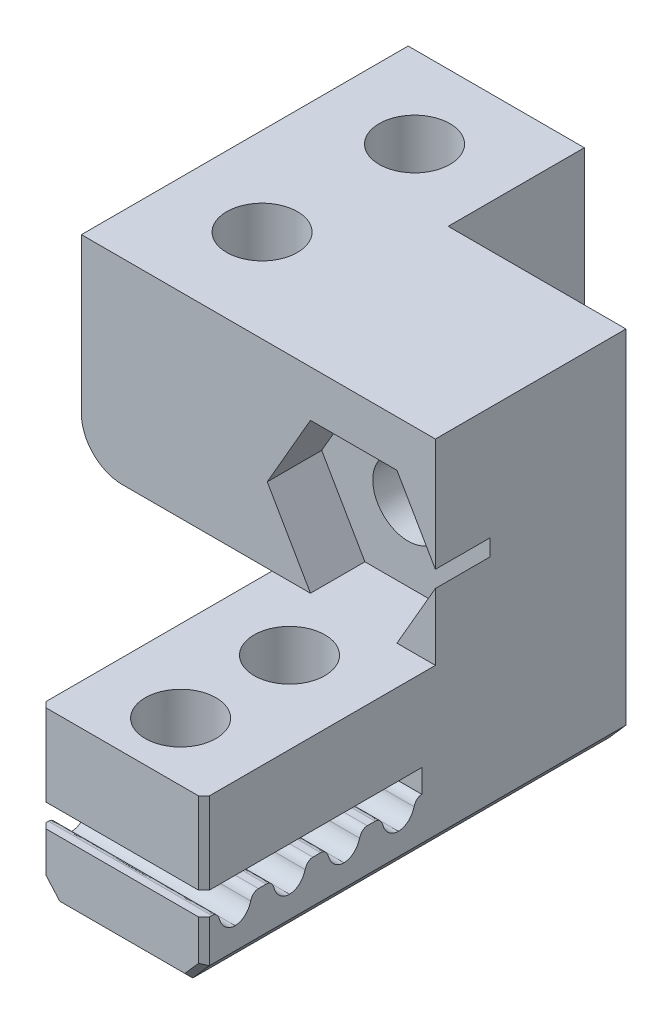
from build123d import *

# Parameters (mm, degrees)
BOSS_EXTRUDE1_DEPTH     = 13
SKETCH6_W               = 6
SKETCH6_H               = 5
BOSS_EXTRUDE4_DEPTH     = 5.6
SKETCH16_W              = 6
SKETCH16_H              = 8
BOSS_EXTRUDE5_DEPTH     = 0.1
CUT_EXTRUDE6_DEPTH      = 4
CUT_EXTRUDE6_DEPTH_BACK = 3.6
SKETCH15_R              = 1.3
CUT_EXTRUDE7_DEPTH      = 8.7202
CUT_EXTRUDE8_START      = -0.2202
SKETCH19_W              = 6
SKETCH19_H              = 8
SKETCH19_R              = 1.3
CUT_EXTRUDE8_DEPTH      = 0.2202
SKETCH12_R              = 1.2
CUT_EXTRUDE5_DEPTH      = 6
SKETCH21_R              = 1.2
BOSS_EXTRUDE6_DEPTH     = 2.5
SKETCH24_W              = 6
SKETCH24_H              = 5.5
CUT_EXTRUDE10_DEPTH     = 8.5
BOSS_EXTRUDE8_DEPTH     = 7.2
FILLET4_R               = 1.5
SKETCH26_R              = 1.3
CUT_EXTRUDE11_DEPTH     = 10
CHAMFER1_SIZE           = 0.2
BOSS_EXTRUDE9_DEPTH     = 5
SKETCH31_R              = 1.3
CUT_EXTRUDE12_DEPTH     = 8
CROQUIS1_W              = 20.968017067
CROQUIS1_H              = 19.092350392
CORTAR_EXTRUIR1_DEPTH   = 0.5
CORTAR_EXTRUIR2_DEPTH   = 2


with BuildPart() as part:
    # Sketch1 → Boss-Extrude1 (new body)
    with BuildSketch(Plane.XY):
        Polygon((3, 3.05), (3, -2.253801214), (2.388188946, -2.95), (-2.388188946, -2.95), (-3, -2.253801214), (-3, 3.05), align=None)
    extrude(amount=BOSS_EXTRUDE1_DEPTH)

    # Sketch6 → Boss-Extrude4 (add)
    with BuildSketch(Plane(origin=(0, 3.05, 0), x_dir=(1, 0, 0), z_dir=(0, 1, 0))):
        with Locations((0, -2.5)):
            Rectangle(SKETCH6_W, SKETCH6_H)
    extrude(amount=BOSS_EXTRUDE4_DEPTH)

    # Sketch16 → Boss-Extrude5 (add)
    with BuildSketch(Plane(origin=(0, 3.05, 0), x_dir=(1, 0, 0), z_dir=(0, 1, 0))):
        with Locations((0, -9)):
            Rectangle(SKETCH16_W, SKETCH16_H)
    extrude(amount=BOSS_EXTRUDE5_DEPTH)

    # Sketch18 → Cut-Extrude6 (cut, two sides: drawn at the far end of the back side and taken through both)
    with BuildSketch(Plane(origin=(0, 0, 0), x_dir=(0, 0, -1), z_dir=(1, 0, 0)).offset(-CUT_EXTRUDE6_DEPTH_BACK)):
        with BuildLine():
            Line((-8.8572, -0.0702), (-12.8572, -0.0702))
            Line((-12.8572, -0.0702), (-13, -0.0702))
            Line((-13, -0.0702), (-13, -0.7))
            Line((-13, -0.7), (-12.8572, -0.7))
            Line((-12.8572, -0.7), (-12.7144, -0.7))
            add(Edge.make_bspline(
                [(-12.7144, -0.7), (-12.5198, -0.7), (-12.43, -0.9509)],
                knots=[0.103448276, 0.103448276, 0.103448276, 0.137931034, 0.137931034, 0.137931034], degree=2))
            add(Edge.make_bspline(
                [(-12.43, -0.9509), (-12.3594, -1.2388), (-12.13, -1.45), (-11.8572, -1.45)],
                knots=[0.137931034, 0.137931034, 0.137931034, 0.137931034, 0.172413793, 0.172413793, 0.172413793, 0.172413793], degree=3))
            add(Edge.make_bspline(
                [(-11.8572, -1.45), (-11.5844, -1.45), (-11.355, -1.2388), (-11.2844, -0.9509)],
                knots=[0.172413793, 0.172413793, 0.172413793, 0.172413793, 0.206896552, 0.206896552, 0.206896552, 0.206896552], degree=3))
            add(Edge.make_bspline(
                [(-11.2844, -0.9509), (-11.1946, -0.7), (-11, -0.7)],
                knots=[0.206896552, 0.206896552, 0.206896552, 0.24137931, 0.24137931, 0.24137931], degree=2))
            Line((-11, -0.7), (-10.8572, -0.7))
            Line((-10.8572, -0.7), (-10.7144, -0.7))
            add(Edge.make_bspline(
                [(-10.7144, -0.7), (-10.5198, -0.7), (-10.43, -0.9509)],
                knots=[0.310344828, 0.310344828, 0.310344828, 0.344827586, 0.344827586, 0.344827586], degree=2))
            add(Edge.make_bspline(
                [(-10.43, -0.9509), (-10.3594, -1.2388), (-10.13, -1.45), (-9.8572, -1.45)],
                knots=[0.344827586, 0.344827586, 0.344827586, 0.344827586, 0.379310345, 0.379310345, 0.379310345, 0.379310345], degree=3))
            add(Edge.make_bspline(
                [(-9.8572, -1.45), (-9.5844, -1.45), (-9.355, -1.2388), (-9.2844, -0.9509)],
                knots=[0.379310345, 0.379310345, 0.379310345, 0.379310345, 0.413793103, 0.413793103, 0.413793103, 0.413793103], degree=3))
            add(Edge.make_bspline(
                [(-9.2844, -0.9509), (-9.1946, -0.7), (-9, -0.7)],
                knots=[0.413793103, 0.413793103, 0.413793103, 0.448275862, 0.448275862, 0.448275862], degree=2))
            Line((-9, -0.7), (-8.8572, -0.7))
            Line((-8.8572, -0.7), (-8.7144, -0.7))
            add(Edge.make_bspline(
                [(-8.7144, -0.7), (-8.5198, -0.7), (-8.43, -0.9509)],
                knots=[0.517241379, 0.517241379, 0.517241379, 0.551724138, 0.551724138, 0.551724138], degree=2))
            add(Edge.make_bspline(
                [(-8.43, -0.9509), (-8.3594, -1.2388), (-8.13, -1.45), (-7.8572, -1.45)],
                knots=[0.551724138, 0.551724138, 0.551724138, 0.551724138, 0.586206897, 0.586206897, 0.586206897, 0.586206897], degree=3))
            add(Edge.make_bspline(
                [(-7.8572, -1.45), (-7.5844, -1.45), (-7.355, -1.2388), (-7.2844, -0.9509)],
                knots=[0.586206897, 0.586206897, 0.586206897, 0.586206897, 0.620689655, 0.620689655, 0.620689655, 0.620689655], degree=3))
            add(Edge.make_bspline(
                [(-7.2844, -0.9509), (-7.1946, -0.7), (-7, -0.7)],
                knots=[0.620689655, 0.620689655, 0.620689655, 0.655172414, 0.655172414, 0.655172414], degree=2))
            Line((-7, -0.7), (-6.8572, -0.7))
            Line((-6.8572, -0.7), (-6.7144, -0.7))
            add(Edge.make_bspline(
                [(-6.7144, -0.7), (-6.5198, -0.7), (-6.43, -0.9509)],
                knots=[0.724137931, 0.724137931, 0.724137931, 0.75862069, 0.75862069, 0.75862069], degree=2))
            add(Edge.make_bspline(
                [(-6.43, -0.9509), (-6.3594, -1.2388), (-6.13, -1.45), (-5.8572, -1.45)],
                knots=[0.75862069, 0.75862069, 0.75862069, 0.75862069, 0.793103448, 0.793103448, 0.793103448, 0.793103448], degree=3))
            add(Edge.make_bspline(
                [(-5.8572, -1.45), (-5.5844, -1.45), (-5.355, -1.2388), (-5.2844, -0.9509)],
                knots=[0.793103448, 0.793103448, 0.793103448, 0.793103448, 0.827586207, 0.827586207, 0.827586207, 0.827586207], degree=3))
            add(Edge.make_bspline(
                [(-5.2844, -0.9509), (-5.1946, -0.7), (-5, -0.7)],
                knots=[0.827586207, 0.827586207, 0.827586207, 0.862068966, 0.862068966, 0.862068966], degree=2))
            Line((-5, -0.7), (-5, -0.0702))
            Line((-5, -0.0702), (-8.8572, -0.0702))
        make_face()
    extrude(amount=CUT_EXTRUDE6_DEPTH + CUT_EXTRUDE6_DEPTH_BACK, mode=Mode.SUBTRACT)

    # Sketch15 → Cut-Extrude7 (cut)
    with BuildSketch(Plane(origin=(0, 8.65, 0), x_dir=(1, 0, 0), z_dir=(0, 1, 0))):
        with Locations(Location((0, -10.8572, 0), (0, 0, 180))):
            Circle(SKETCH15_R)
        with Locations(Location((0, -6.8572, 0), (0, 0, 180))):
            Circle(SKETCH15_R)
    extrude(amount=-CUT_EXTRUDE7_DEPTH, mode=Mode.SUBTRACT)

    # Sketch19 → Cut-Extrude8 (cut)
    with BuildSketch(Plane.XZ.offset(0.0702).offset(CUT_EXTRUDE8_START)):
        with Locations((0, 9)):
            Rectangle(SKETCH19_W, SKETCH19_H)
        with Locations(Location((0, 10.8572, 0), (0, 0, 180))):
            Circle(SKETCH19_R, mode=Mode.SUBTRACT)
        with Locations(Location((0, 6.8572, 0), (0, 0, 180))):
            Circle(SKETCH19_R, mode=Mode.SUBTRACT)
    extrude(amount=CUT_EXTRUDE8_DEPTH, mode=Mode.SUBTRACT)

    # Sketch12 → Cut-Extrude5 (cut)
    with BuildSketch(Plane.XY.offset(5)):
        with Locations((0, 5.85)):
            Circle(SKETCH12_R)
    extrude(amount=-CUT_EXTRUDE5_DEPTH, mode=Mode.SUBTRACT)

    # Sketch21 → Boss-Extrude6 (add)
    with BuildSketch(Plane(origin=(0, 0, 0), x_dir=(-1, 0, 0), z_dir=(0, 0, -1))):
        Polygon((-2.388188946, -2.95), (2.388188946, -2.95), (3, -2.253801214), (3, 8.65), (-3, 8.65), (-3, -2.253801214), align=None)
        with Locations(Location((0, 5.85, 0), (0, 0, 180))):
            Circle(SKETCH21_R, mode=Mode.SUBTRACT)
    extrude(amount=BOSS_EXTRUDE6_DEPTH)

    # Sketch24 → Cut-Extrude10 (cut)
    with BuildSketch(Plane.XY.offset(5)):
        with Locations((0, 5.9)):
            Rectangle(SKETCH24_W, SKETCH24_H)
    extrude(amount=-CUT_EXTRUDE10_DEPTH, mode=Mode.SUBTRACT)

    # Sketch25 → Boss-Extrude8 (add)
    with BuildSketch(Plane(origin=(0, 3.15, 0), x_dir=(1, 0, 0), z_dir=(0, 1, 0))):
        Polygon((-10, -4.5), (0, -4.5), (3.5, -4.5), (3.5, 2.5), (-10, 2.5), align=None)
    extrude(amount=BOSS_EXTRUDE8_DEPTH)

    # Fillet4
    fillet4_edges = [part.edges().sort_by_distance(p)[0] for p in [
        (-10, 3.15, 1),
    ]]
    fillet(fillet4_edges, radius=FILLET4_R)

    # Sketch26 → Cut-Extrude11 (cut)
    with BuildSketch(Plane.XY.offset(4.5)):
        with Locations((0, 5.9)):
            Circle(SKETCH26_R)
    extrude(amount=-CUT_EXTRUDE11_DEPTH, mode=Mode.SUBTRACT)

    # Chamfer1
    chamfer1_edges = [part.edges().sort_by_distance(p)[0] for p in [
        (-2.694094473, -2.601900607, 13),
        (0, -2.95, 13),
        (2.694094473, -2.601900607, 13),
        (3, 1.65, 13),
        (3, -1.476900607, 13),
        (-3, -1.476900607, 13),
        (-3, 1.65, 13),
    ]]
    chamfer(chamfer1_edges, length=CHAMFER1_SIZE)

    # Sketch29 → Boss-Extrude9 (add)
    with BuildSketch(Plane(origin=(0, 0, -2.5), x_dir=(-1, 0, 0), z_dir=(0, 0, -1))):
        with BuildLine():
            Line((3.53, 3.15), (3.53, 10.35))
            Line((3.53, 10.35), (10, 10.35))
            Line((10, 10.35), (10, 4.65))
            ThreePointArc((10, 4.65), (9.560660172, 3.589339828), (8.5, 3.15))
            Line((8.5, 3.15), (3.53, 3.15))
        make_face()
    extrude(amount=BOSS_EXTRUDE9_DEPTH)

    # Sketch31 → Cut-Extrude12 (cut)
    with BuildSketch(Plane(origin=(0, 10.35, 0), x_dir=(1, 0, 0), z_dir=(0, 1, 0))):
        with Locations(Location((-6.765, 4.5, 0), (0, 0, 180))):
            Circle(SKETCH31_R)
        with Locations(Location((-6.765, -1.1, 0), (0, 0, 180))):
            Circle(SKETCH31_R)
    extrude(amount=-CUT_EXTRUDE12_DEPTH, mode=Mode.SUBTRACT)

    # Croquis1 → Cortar-Extruir1 (cut)
    with BuildSketch(Plane(origin=(3.5, 0, 0), x_dir=(0, 0, -1), z_dir=(1, 0, 0))):
        with Locations((-1.115538408, 6.705636454)):
            Rectangle(CROQUIS1_W, CROQUIS1_H)
    extrude(amount=-CORTAR_EXTRUIR1_DEPTH, mode=Mode.SUBTRACT)

    # Croquis2 → Cortar-Extruir2 (cut)
    with BuildSketch(Plane.XY.offset(4.5)):
        Polygon((1.58771324, 8.65), (-1.58771324, 8.65), (-3.175426481, 5.9), (-1.58771324, 3.15), (1.58771324, 3.15), (3.175426481, 5.9), align=None)
    extrude(amount=-CORTAR_EXTRUIR2_DEPTH, mode=Mode.SUBTRACT)


solid = part.part
